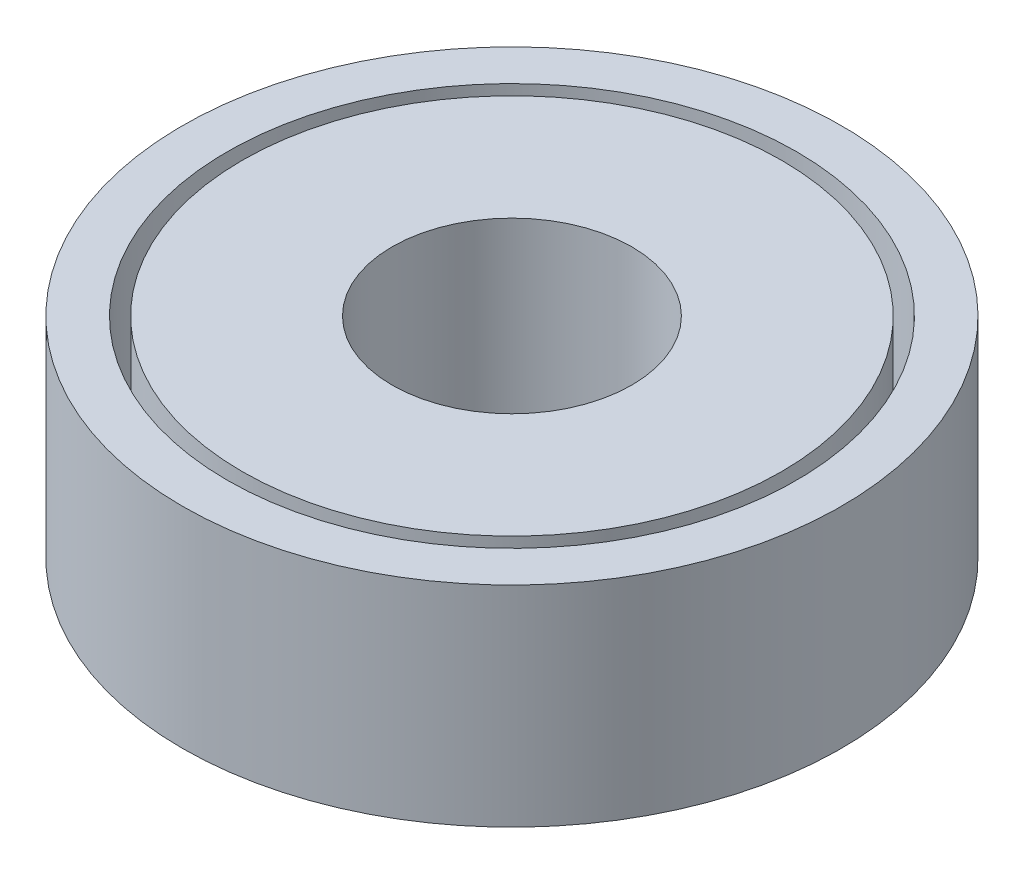
from build123d import *

# Parameters (mm, degrees)
SKETCH1_R           = 11
BOSS_EXTRUDE1_DEPTH = 7
SKETCH2_R           = 9.5
CUT_EXTRUDE1_DEPTH  = 7
SKETCH3_R           = 9
BOSS_EXTRUDE2_DEPTH = 7
SKETCH5_R           = 4
CUT_EXTRUDE2_DEPTH  = 7


with BuildPart() as part:
    # Sketch1 → Boss-Extrude1 (new body)
    with BuildSketch(Plane(origin=(0, 0, 0), x_dir=(1, 0, 0), z_dir=(0, 1, 0))):
        with Locations(Location((0, 0, 0), (0, 0, 270))):
            Circle(SKETCH1_R)
    extrude(amount=BOSS_EXTRUDE1_DEPTH)

    # Sketch2 → Cut-Extrude1 (cut)
    with BuildSketch(Plane(origin=(0, 7, 0), x_dir=(1, 0, 0), z_dir=(0, 1, 0))):
        with Locations(Location((0, 0, 0), (0, 0, 270))):
            Circle(SKETCH2_R)
    extrude(amount=-CUT_EXTRUDE1_DEPTH, mode=Mode.SUBTRACT)


with BuildPart() as body_2:
    # Sketch3 → Boss-Extrude2 (new body)
    with BuildSketch(Plane(origin=(0, 0, 0), x_dir=(1, 0, 0), z_dir=(0, 1, 0))):
        with Locations(Location((0, 0, 0), (0, 0, 270))):
            Circle(SKETCH3_R)
    extrude(amount=BOSS_EXTRUDE2_DEPTH)

    # Sketch5 → Cut-Extrude2 (cut)
    with BuildSketch(Plane.XZ):
        with Locations(Location((0, 0, 0), (0, 0, 270))):
            Circle(SKETCH5_R)
    extrude(amount=-CUT_EXTRUDE2_DEPTH, mode=Mode.SUBTRACT)


solid = Compound([part.part, body_2.part])
